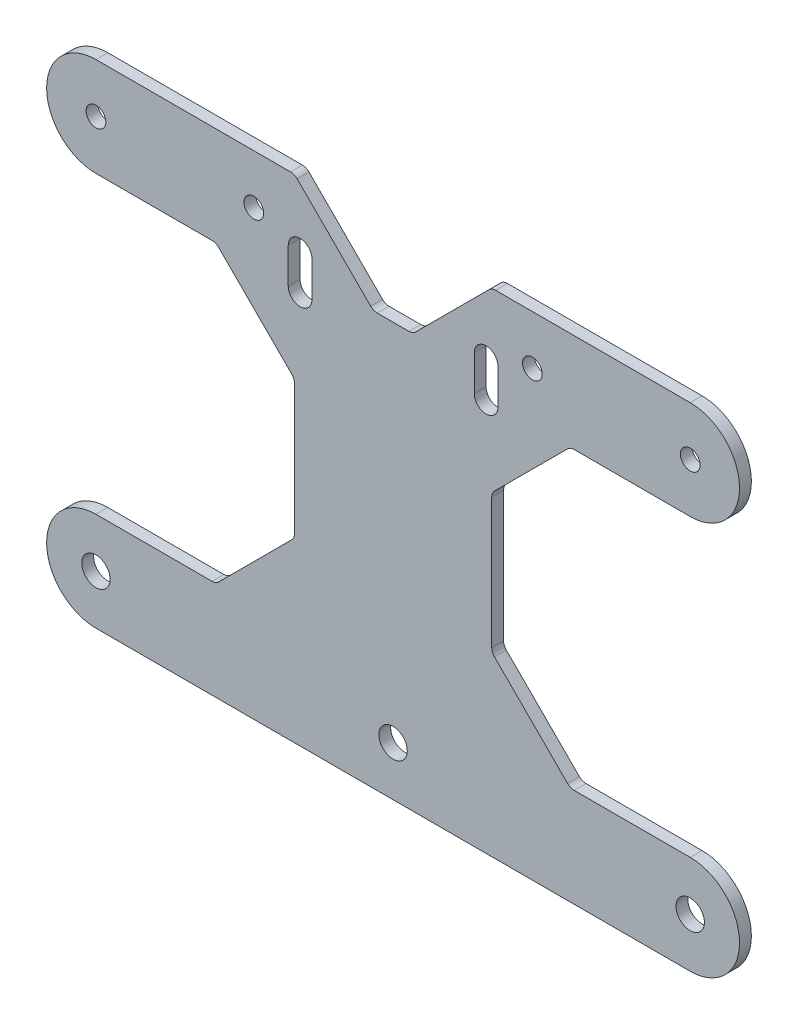
from build123d import *

# Parameters (mm, degrees)
MODEL_R             = 3.6
MODEL_R_2           = 2.5
BOSS_EXTRUDE1_DEPTH = 3


with BuildPart() as part:
    # Model → Boss-Extrude1 (new body)
    with BuildSketch(Plane.XY):
        with BuildLine():
            Line((-75.3, 0), (75.3, 0))
            ThreePointArc((75.3, 0), (87.8, 12.5), (75.3, 25))
            Line((75.3, 25), (45.873401872, 25))
            ThreePointArc((45.873401872, 25), (44.974095806, 25.178883099), (44.211700936, 25.688299064))
            Line((44.211700936, 25.688299064), (25.688299064, 44.211700936))
            ThreePointArc((25.688299064, 44.211700936), (25.178883099, 44.974095805), (25, 45.873401872))
            Line((25, 45.873401872), (25, 78.926598129))
            ThreePointArc((25, 78.926598129), (25.178883099, 79.825904195), (25.688299064, 80.588299064))
            Line((25.688299064, 80.588299064), (44.211700936, 99.111700936))
            ThreePointArc((44.211700936, 99.111700936), (44.974095806, 99.621116901), (45.873401872, 99.8))
            Line((45.873401872, 99.8), (75.3, 99.8))
            ThreePointArc((75.3, 99.8), (87.8, 112.3), (75.3, 124.8))
            Line((75.3, 124.8), (25.973401872, 124.8))
            ThreePointArc((25.973401872, 124.8), (25.074095806, 124.621116901), (24.311700936, 124.111700936))
            Line((24.311700936, 124.111700936), (5.688299064, 105.488299064))
            ThreePointArc((5.688299064, 105.488299064), (4.925904195, 104.978883099), (4.026598129, 104.8))
            Line((4.026598129, 104.8), (-4.026598129, 104.8))
            ThreePointArc((-4.026598129, 104.8), (-4.925904195, 104.978883099), (-5.688299064, 105.488299064))
            Line((-5.688299064, 105.488299064), (-24.311700936, 124.111700936))
            ThreePointArc((-24.311700936, 124.111700936), (-25.074095806, 124.621116901), (-25.973401872, 124.8))
            Line((-25.973401872, 124.8), (-75.3, 124.8))
            ThreePointArc((-75.3, 124.8), (-87.8, 112.3), (-75.3, 99.8))
            Line((-75.3, 99.8), (-45.873401872, 99.8))
            ThreePointArc((-45.873401872, 99.8), (-44.974095806, 99.621116901), (-44.211700936, 99.111700936))
            Line((-44.211700936, 99.111700936), (-25.688299064, 80.588299064))
            ThreePointArc((-25.688299064, 80.588299064), (-25.178883099, 79.825904195), (-25, 78.926598129))
            Line((-25, 78.926598129), (-25, 45.873401872))
            ThreePointArc((-25, 45.873401872), (-25.178883099, 44.974095805), (-25.688299064, 44.211700936))
            Line((-25.688299064, 44.211700936), (-44.211700936, 25.688299064))
            ThreePointArc((-44.211700936, 25.688299064), (-44.974095806, 25.178883099), (-45.873401872, 25))
            Line((-45.873401872, 25), (-75.3, 25))
            ThreePointArc((-75.3, 25), (-87.8, 12.5), (-75.3, 0))
        make_face()
        with Locations(Location((75.3, 12.5, 0), (0, 0, 180))):
            Circle(MODEL_R, mode=Mode.SUBTRACT)
        with Locations((0, 12.5)):
            Circle(MODEL_R, mode=Mode.SUBTRACT)
        with Locations((-75.3, 12.5)):
            Circle(MODEL_R, mode=Mode.SUBTRACT)
        with Locations((-35.3, 112.3)):
            Circle(MODEL_R_2, mode=Mode.SUBTRACT)
        with Locations((-75.3, 112.3)):
            Circle(MODEL_R_2, mode=Mode.SUBTRACT)
        with Locations(Location((35.3, 112.3, 0), (0, 0, 180))):
            Circle(MODEL_R_2, mode=Mode.SUBTRACT)
        with Locations(Location((75.3, 112.3, 0), (0, 0, 180))):
            Circle(MODEL_R_2, mode=Mode.SUBTRACT)
        with BuildLine():
            Line((26.57, 99.43), (26.57, 108.43))
            ThreePointArc((26.57, 108.43), (23.57, 111.43), (20.57, 108.43))
            Line((20.57, 108.43), (20.57, 99.43))
            ThreePointArc((20.57, 99.43), (23.57, 96.43), (26.57, 99.43))
        make_face(mode=Mode.SUBTRACT)
        with BuildLine():
            Line((-26.57, 99.43), (-26.57, 108.43))
            ThreePointArc((-26.57, 108.43), (-23.57, 111.43), (-20.57, 108.43))
            Line((-20.57, 108.43), (-20.57, 99.43))
            ThreePointArc((-20.57, 99.43), (-23.57, 96.43), (-26.57, 99.43))
        make_face(mode=Mode.SUBTRACT)
    extrude(amount=BOSS_EXTRUDE1_DEPTH)


solid = part.part
